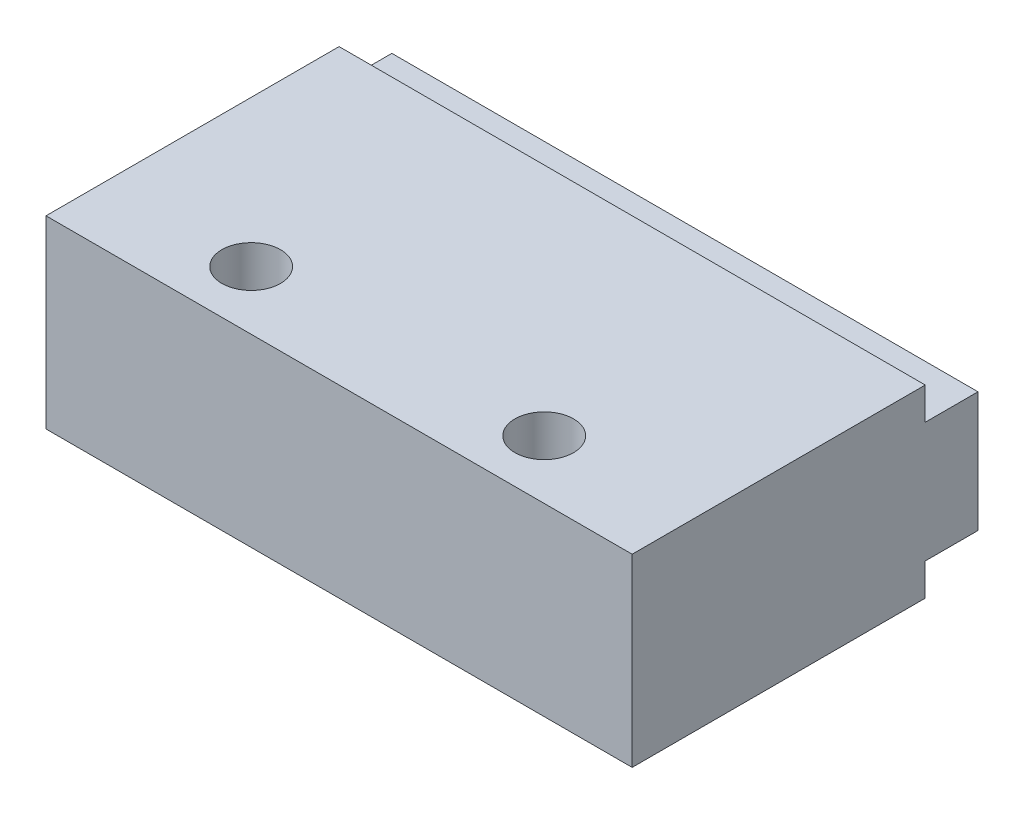
from build123d import *

# Parameters (mm, degrees)
SKETCH1_W           = 20
SKETCH1_H           = 10
BOSS_EXTRUDE1_DEPTH = 6.3
SKETCH2_W           = 20
SKETCH2_H           = 4.1
BOSS_EXTRUDE2_DEPTH = 1.8
SKETCH3_R           = 1
CUT_EXTRUDE1_DEPTH  = 25.060964237


with BuildPart() as part:
    # Sketch1 → Boss-Extrude1 (new body)
    with BuildSketch(Plane(origin=(0, 0, 0), x_dir=(1, 0, 0), z_dir=(0, 1, 0))):
        with Locations((10, 5)):
            Rectangle(SKETCH1_W, SKETCH1_H)
    extrude(amount=BOSS_EXTRUDE1_DEPTH)

    # Sketch2 → Boss-Extrude2 (add)
    with BuildSketch(Plane(origin=(0, 0, -10), x_dir=(-1, 0, 0), z_dir=(0, 0, -1))):
        with Locations((-10, 3.15)):
            Rectangle(SKETCH2_W, SKETCH2_H)
    extrude(amount=BOSS_EXTRUDE2_DEPTH)

    # Sketch3 → Cut-Extrude1 (cut, through all)
    with BuildSketch(Plane(origin=(0, 6.3, 0), x_dir=(1, 0, 0), z_dir=(0, 1, 0))):
        with Locations(Location((5, 2, 0), (0, 0, 270))):
            Circle(SKETCH3_R)
        with Locations(Location((15, 2, 0), (0, 0, 270))):
            Circle(SKETCH3_R)
    extrude(amount=-CUT_EXTRUDE1_DEPTH, mode=Mode.SUBTRACT)


solid = part.part
